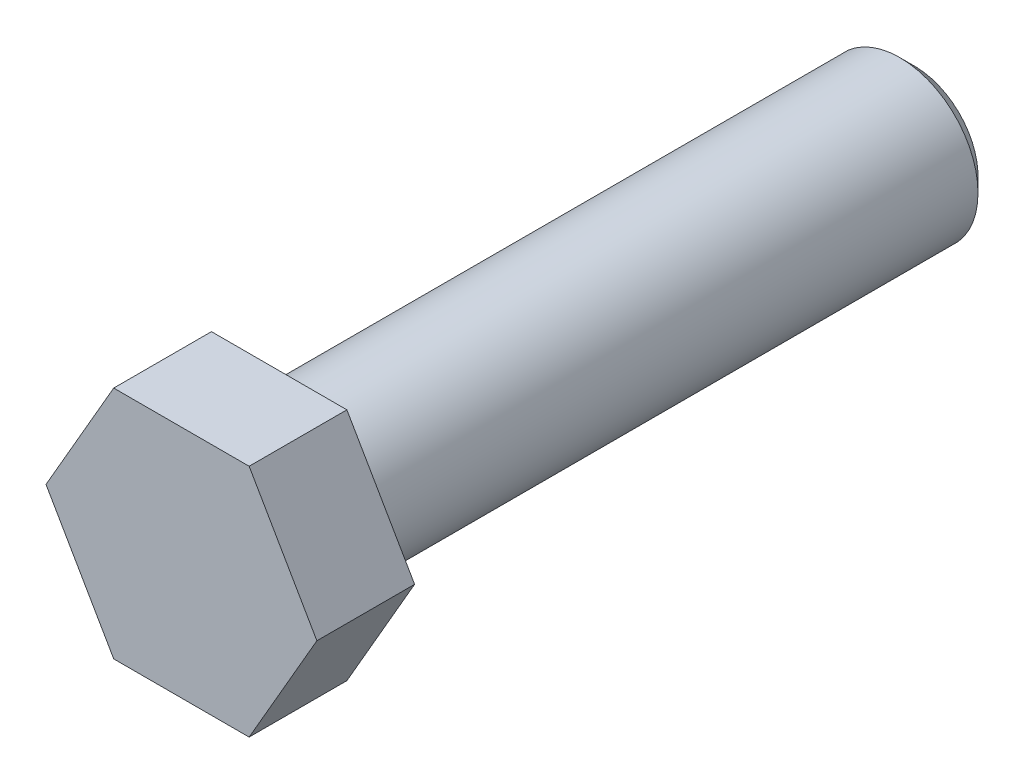
from build123d import *

# Parameters (mm, degrees)
BASE_EXTRUDE_DEPTH  = 10
SKETCH3_R           = 8
BOSS_EXTRUDE1_DEPTH = 65
CHAMFER1_SIZE       = 1.5


with BuildPart() as part:
    # Sketch1 → Base-Extrude (new body)
    with BuildSketch(Plane.XY):
        Polygon((-6.92820323, 12), (6.92820323, 12), (13.856406461, 0), (6.92820323, -12), (-6.92820323, -12), (-13.856406461, 0), align=None)
    extrude(amount=BASE_EXTRUDE_DEPTH)

    # Sketch3 → Boss-Extrude1 (add)
    with BuildSketch(Plane(origin=(0, 0, 0), x_dir=(-1, 0, 0), z_dir=(0, 0, -1))):
        with Locations(Location((0, 0, 0), (0, 0, 180))):
            Circle(SKETCH3_R)
    extrude(amount=BOSS_EXTRUDE1_DEPTH)

    # Chamfer1
    chamfer1_edges = [part.edges().sort_by_distance(p)[0] for p in [
        (-8, 0, -65),
    ]]
    chamfer(chamfer1_edges, length=CHAMFER1_SIZE)


solid = part.part
